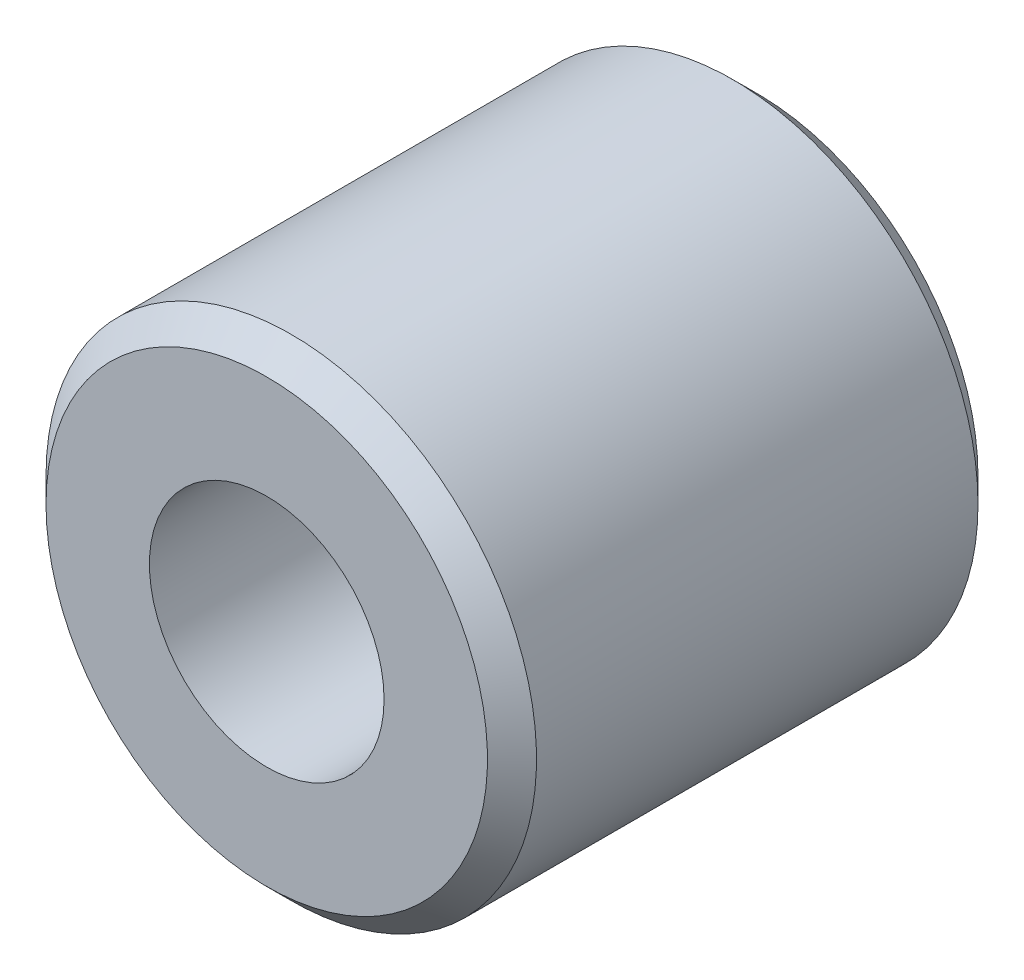
from build123d import *

# Parameters (mm, degrees)
SKETCH1_R              = 3.96875
EXTRUDE1_DEPTH         = 7.9375
CHAMFER1_SIZE          = 0.396875
F_10_24_TAPPED_HOLE1_D = 3.7973


with BuildPart() as part:
    # Sketch1 → Extrude1 (new body)
    with BuildSketch(Plane.XY):
        Circle(SKETCH1_R)
    extrude(amount=EXTRUDE1_DEPTH)

    # Chamfer1
    chamfer1_edges = [part.edges().sort_by_distance(p)[0] for p in [
        (-3.96875, 0, 0),
        (-3.96875, 0, 7.9375),
    ]]
    chamfer(chamfer1_edges, length=CHAMFER1_SIZE)

    # #10-24 Tapped Hole1 (through all)
    with Locations(Plane.XY.offset(7.9375)):
        with Locations((0, 0)):
            Hole(F_10_24_TAPPED_HOLE1_D / 2)


solid = part.part
